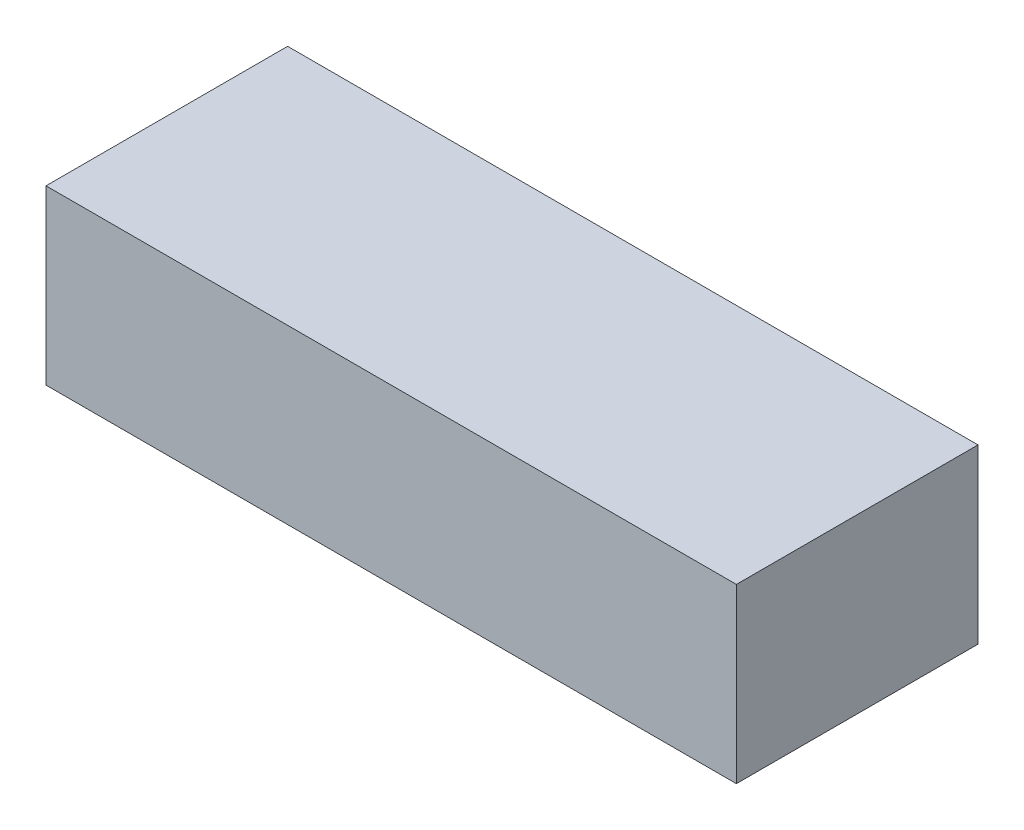
from build123d import *

# Parameters (mm, degrees)
SKETCH1_W           = 100
SKETCH1_H           = 35
BOSS_EXTRUDE1_DEPTH = 25


with BuildPart() as part:
    # Sketch1 → Boss-Extrude1 (new body)
    with BuildSketch(Plane(origin=(0, 0, 0), x_dir=(1, 0, 0), z_dir=(0, 1, 0))):
        Rectangle(SKETCH1_W, SKETCH1_H)
    extrude(amount=BOSS_EXTRUDE1_DEPTH)


solid = part.part
